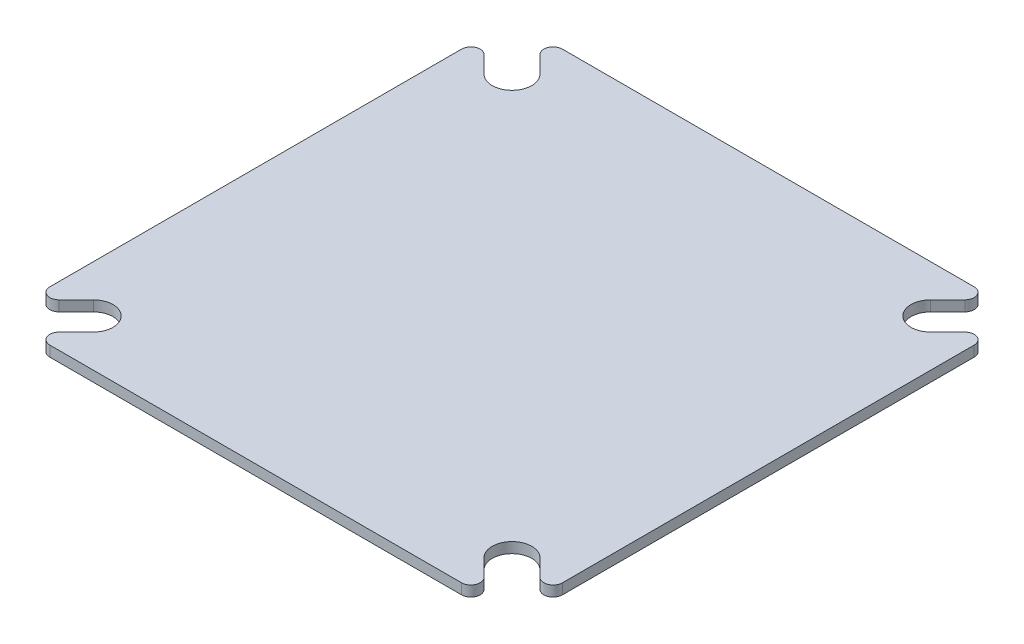
from build123d import *

# Parameters (mm, degrees)
SKETCH1_W           = 279.4
SKETCH1_H           = 279.4
BOSS_EXTRUDE1_DEPTH = 5.715
CUT_EXTRUDE4_REACH  = 199.648
SKETCH6_R           = 5.0419
CUT_EXTRUDE6_REACH  = 199.648
FILLET1_R           = 5.08


with BuildPart() as part:
    # Sketch1 → Boss-Extrude1 (new body)
    with BuildSketch(Plane(origin=(0, 0, 0), x_dir=(1, 0, 0), z_dir=(0, 1, 0))):
        Rectangle(SKETCH1_W, SKETCH1_H)
    extrude(amount=BOSS_EXTRUDE1_DEPTH)

    # Sketch6 → Cut-Extrude4 (cut, up to next)
    with BuildSketch(Plane(origin=(0, 5.715, 0), x_dir=(1, 0, 0), z_dir=(0, 1, 0)), mode=Mode.PRIVATE) as cut_extrude4_sk1:
        with Locations((-114.3, 114.3)):
            Circle(SKETCH6_R)
    cut_extrude4_tool1 = extrude(cut_extrude4_sk1.sketch, amount=-CUT_EXTRUDE4_REACH, mode=Mode.PRIVATE) & part.part
    # Sketch6 → Cut-Extrude4 (cut, up to next)
    with BuildSketch(Plane(origin=(0, 5.715, 0), x_dir=(1, 0, 0), z_dir=(0, 1, 0)), mode=Mode.PRIVATE) as cut_extrude4_sk2:
        with Locations((114.3, 114.3)):
            Circle(SKETCH6_R)
    cut_extrude4_tool2 = extrude(cut_extrude4_sk2.sketch, amount=-CUT_EXTRUDE4_REACH, mode=Mode.PRIVATE) & part.part
    # Sketch6 → Cut-Extrude4 (cut, up to next)
    with BuildSketch(Plane(origin=(0, 5.715, 0), x_dir=(1, 0, 0), z_dir=(0, 1, 0)), mode=Mode.PRIVATE) as cut_extrude4_sk3:
        with Locations((114.3, -114.3)):
            Circle(SKETCH6_R)
    cut_extrude4_tool3 = extrude(cut_extrude4_sk3.sketch, amount=-CUT_EXTRUDE4_REACH, mode=Mode.PRIVATE) & part.part
    # Sketch6 → Cut-Extrude4 (cut, up to next)
    with BuildSketch(Plane(origin=(0, 5.715, 0), x_dir=(1, 0, 0), z_dir=(0, 1, 0)), mode=Mode.PRIVATE) as cut_extrude4_sk4:
        with Locations((-114.3, -114.3)):
            Circle(SKETCH6_R)
    cut_extrude4_tool4 = extrude(cut_extrude4_sk4.sketch, amount=-CUT_EXTRUDE4_REACH, mode=Mode.PRIVATE) & part.part
    add(cut_extrude4_tool1.solids().sort_by_distance((-114.3, 5.715, -114.3))[0], mode=Mode.SUBTRACT)
    add(cut_extrude4_tool2.solids().sort_by_distance((114.3, 5.715, -114.3))[0], mode=Mode.SUBTRACT)
    add(cut_extrude4_tool3.solids().sort_by_distance((114.3, 5.715, 114.3))[0], mode=Mode.SUBTRACT)
    add(cut_extrude4_tool4.solids().sort_by_distance((-114.3, 5.715, 114.3))[0], mode=Mode.SUBTRACT)

    # Sketch8 → Cut-Extrude6 (cut, up to next)
    with BuildSketch(Plane(origin=(0, 5.715, 0), x_dir=(1, 0, 0), z_dir=(0, 1, 0)), mode=Mode.PRIVATE) as cut_extrude6_sk1:
        with BuildLine():
            Line((-139.7, 139.7), (-139.7, 124.46))
            Line((-139.7, 124.46), (-121.739487758, 106.499487758))
            ThreePointArc((-121.739487758, 106.499487758), (-106.499487758, 106.499487758), (-106.499487758, 121.739487758))
            Line((-106.499487758, 121.739487758), (-124.46, 139.7))
            Line((-124.46, 139.7), (-139.7, 139.7))
        make_face()
    cut_extrude6_tool1 = extrude(cut_extrude6_sk1.sketch, amount=-CUT_EXTRUDE6_REACH, mode=Mode.PRIVATE) & part.part
    # Sketch8 → Cut-Extrude6 (cut, up to next)
    with BuildSketch(Plane(origin=(0, 5.715, 0), x_dir=(1, 0, 0), z_dir=(0, 1, 0)), mode=Mode.PRIVATE) as cut_extrude6_sk2:
        with BuildLine():
            Line((-124.46, -139.7), (-106.499487758, -121.739487758))
            ThreePointArc((-106.499487758, -121.739487758), (-106.499487758, -106.499487758), (-121.739487758, -106.499487758))
            Line((-121.739487758, -106.499487758), (-139.7, -124.46))
            Line((-139.7, -124.46), (-139.7, -139.7))
            Line((-139.7, -139.7), (-124.46, -139.7))
        make_face()
    cut_extrude6_tool2 = extrude(cut_extrude6_sk2.sketch, amount=-CUT_EXTRUDE6_REACH, mode=Mode.PRIVATE) & part.part
    # Sketch8 → Cut-Extrude6 (cut, up to next)
    with BuildSketch(Plane(origin=(0, 5.715, 0), x_dir=(1, 0, 0), z_dir=(0, 1, 0)), mode=Mode.PRIVATE) as cut_extrude6_sk3:
        with BuildLine():
            Line((139.7, -139.7), (139.7, -124.46))
            Line((139.7, -124.46), (121.739487758, -106.499487758))
            ThreePointArc((121.739487758, -106.499487758), (106.499487758, -106.499487758), (106.499487758, -121.739487758))
            Line((106.499487758, -121.739487758), (124.46, -139.7))
            Line((124.46, -139.7), (139.7, -139.7))
        make_face()
    cut_extrude6_tool3 = extrude(cut_extrude6_sk3.sketch, amount=-CUT_EXTRUDE6_REACH, mode=Mode.PRIVATE) & part.part
    # Sketch8 → Cut-Extrude6 (cut, up to next)
    with BuildSketch(Plane(origin=(0, 5.715, 0), x_dir=(1, 0, 0), z_dir=(0, 1, 0)), mode=Mode.PRIVATE) as cut_extrude6_sk4:
        with BuildLine():
            Line((124.46, 139.7), (106.499487758, 121.739487758))
            ThreePointArc((106.499487758, 121.739487758), (106.499487758, 106.499487758), (121.739487758, 106.499487758))
            Line((121.739487758, 106.499487758), (139.7, 124.46))
            Line((139.7, 124.46), (139.7, 139.7))
            Line((139.7, 139.7), (124.46, 139.7))
        make_face()
    cut_extrude6_tool4 = extrude(cut_extrude6_sk4.sketch, amount=-CUT_EXTRUDE6_REACH, mode=Mode.PRIVATE) & part.part
    add(cut_extrude6_tool1.solids().sort_by_distance((-122.047436, 5.715, -122.047436))[0], mode=Mode.SUBTRACT)
    add(cut_extrude6_tool2.solids().sort_by_distance((-122.047436, 5.715, 122.047436))[0], mode=Mode.SUBTRACT)
    add(cut_extrude6_tool3.solids().sort_by_distance((122.047436, 5.715, 122.047436))[0], mode=Mode.SUBTRACT)
    add(cut_extrude6_tool4.solids().sort_by_distance((122.047436, 5.715, -122.047436))[0], mode=Mode.SUBTRACT)

    # Fillet1
    fillet1_edges = [part.edges().sort_by_distance(p)[0] for p in [
        (124.46, 2.8575, 139.7),
        (139.7, 2.8575, 124.46),
        (-124.46, 2.8575, 139.7),
        (-139.7, 2.8575, 124.46),
        (139.7, 2.8575, -124.46),
        (124.46, 2.8575, -139.7),
        (-139.7, 2.8575, -124.46),
        (-124.46, 2.8575, -139.7),
    ]]
    fillet(fillet1_edges, radius=FILLET1_R)


solid = part.part
